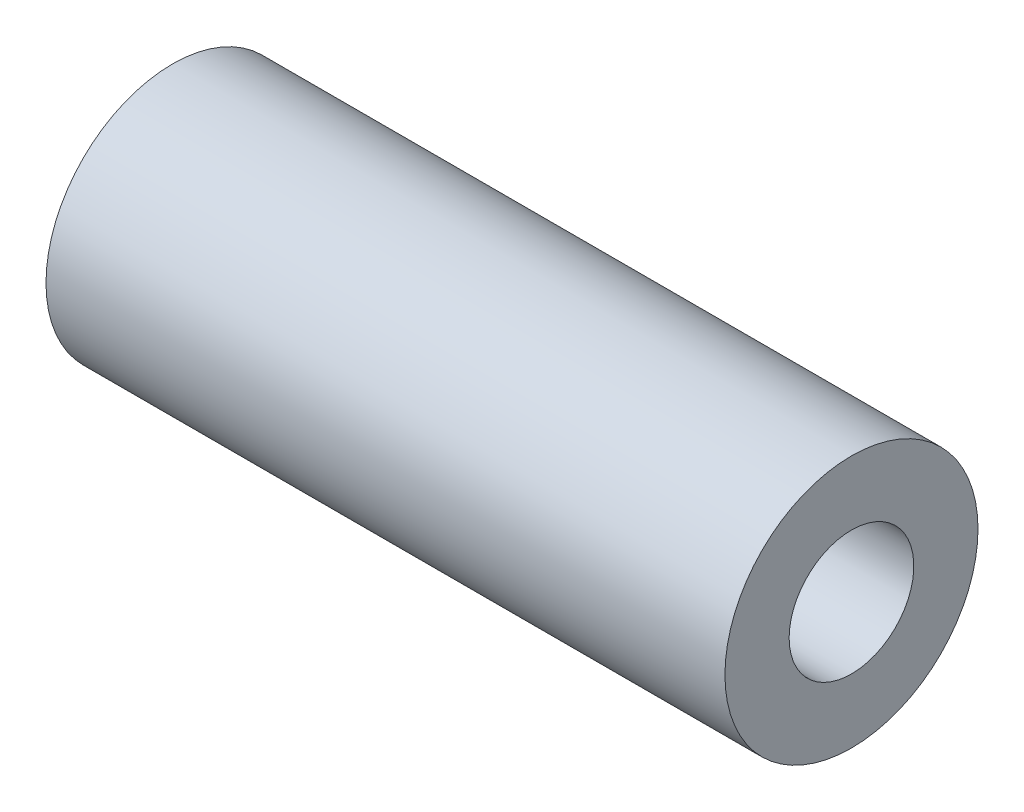
from build123d import *

# Parameters (mm, degrees)
SKETCH1_W = 55
SKETCH1_H = 5.2


with BuildPart() as part:
    # Sketch1 → Revolve1 (revolve)
    with BuildSketch(Plane.XY, mode=Mode.PRIVATE) as revolve1_sk:
        with Locations((-33.5, 2.6)):
            Rectangle(SKETCH1_W, SKETCH1_H)
    revolve(revolve1_sk.sketch.rotate(Axis((-62.913232641, -5.05, 0), (1, 0, 0)), 90), axis=Axis((-62.913232641, -5.05, 0), (1, 0, 0)))


solid = part.part
